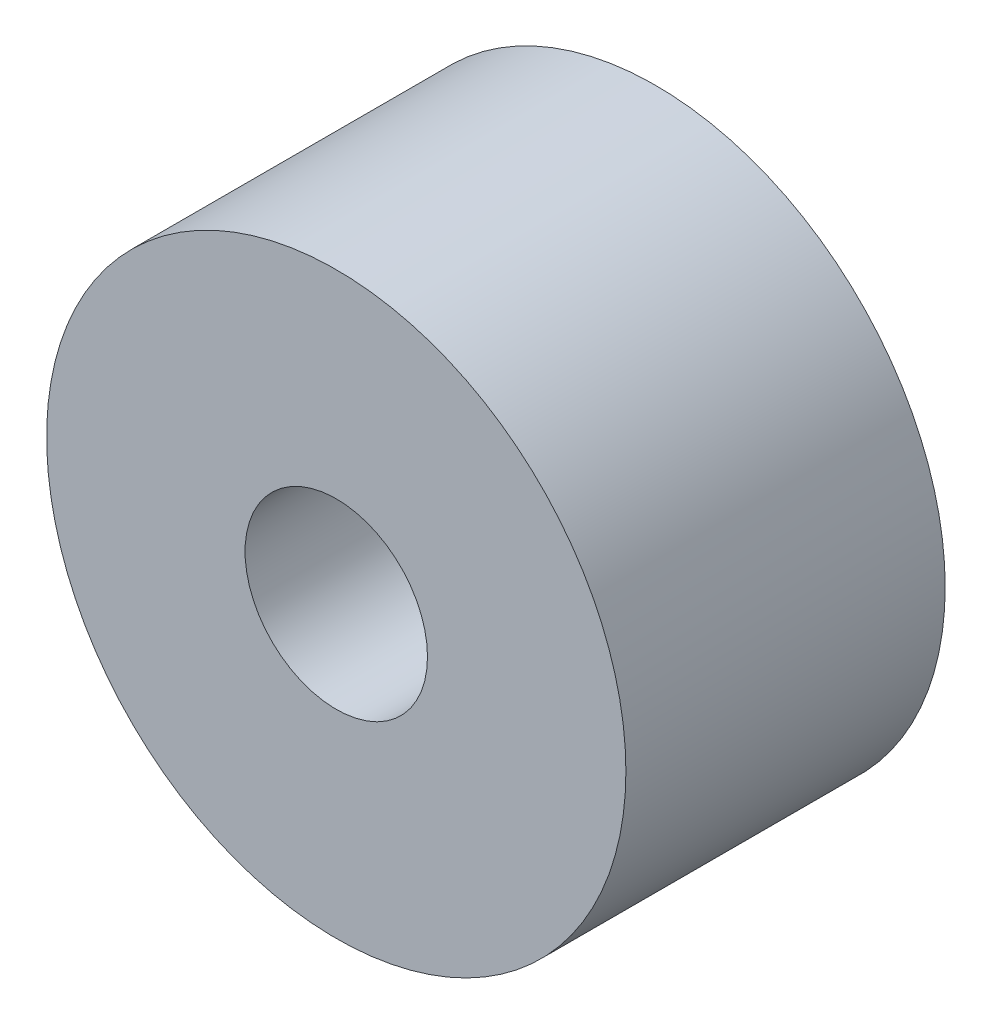
from build123d import *

# Parameters (mm, degrees)
SKETCH1_R           = 12.7
BOSS_EXTRUDE1_DEPTH = 2
SKETCH2_R           = 12.7
SKETCH2_R_2         = 4
BOSS_EXTRUDE2_DEPTH = 12


with BuildPart() as part:
    # Sketch1 → Boss-Extrude1 (new body)
    with BuildSketch(Plane.XY):
        Circle(SKETCH1_R)
    extrude(amount=BOSS_EXTRUDE1_DEPTH)

    # Sketch2 → Boss-Extrude2 (add)
    with BuildSketch(Plane.XY.offset(2)):
        Circle(SKETCH2_R)
        Circle(SKETCH2_R_2, mode=Mode.SUBTRACT)
    extrude(amount=BOSS_EXTRUDE2_DEPTH)


solid = part.part
